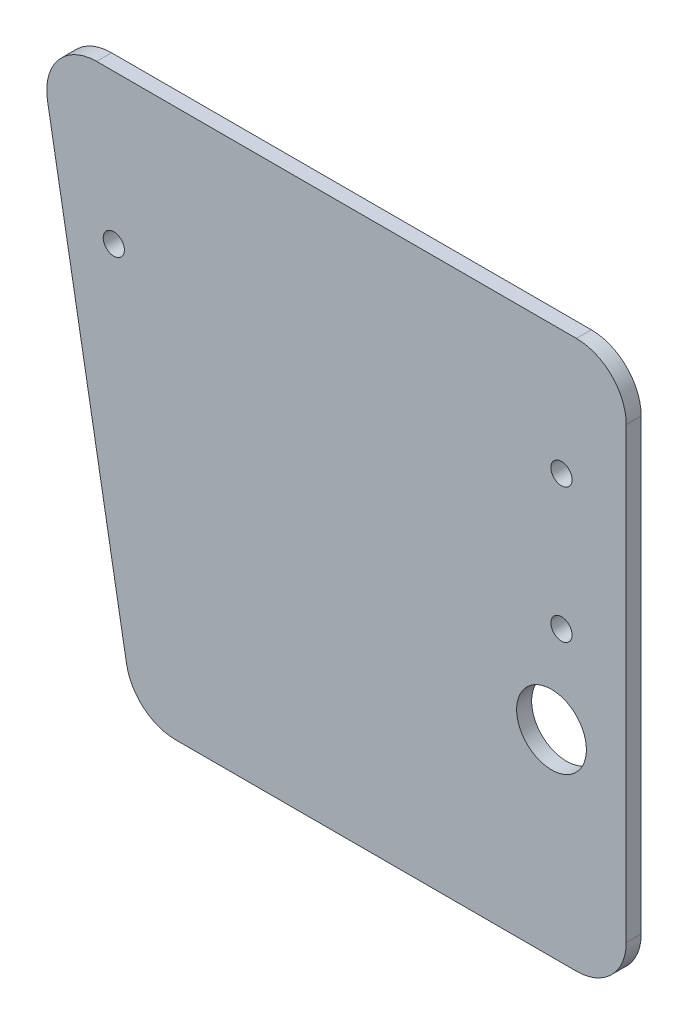
from build123d import *

# Parameters (mm, degrees)
BOSS_EXTRUDE3_DEPTH = 3
SKETCH5_R           = 2.125
SKETCH5_R_2         = 7
CUT_EXTRUDE1_DEPTH  = 10
FILLET1_R           = 10
SKETCH6_R           = 2.125
CUT_EXTRUDE2_DEPTH  = 3


with BuildPart() as part:
    # Sketch4 → Boss-Extrude3 (new body)
    with BuildSketch(Plane.XY):
        Polygon((0, 0), (118.235967878, 0), (118.235967878, -110), (19.395967878, -110), align=None)
    extrude(amount=BOSS_EXTRUDE3_DEPTH)

    # Sketch5 → Cut-Extrude1 (cut)
    with BuildSketch(Plane.XY.offset(3)):
        with Locations((105.235967878, -25)):
            Circle(SKETCH5_R)
        with Locations((15.3749641, -30)):
            Circle(SKETCH5_R)
        with Locations((103.235967878, -70.5)):
            Circle(SKETCH5_R_2)
    extrude(amount=-CUT_EXTRUDE1_DEPTH, mode=Mode.SUBTRACT)

    # Fillet1
    fillet1_edges = [part.edges().sort_by_distance(p)[0] for p in [
        (0, 0, 1.5),
        (118.235967878, 0, 1.5),
        (118.235967878, -110, 1.5),
        (19.395967878, -110, 1.5),
    ]]
    fillet(fillet1_edges, radius=FILLET1_R)

    # Sketch6 → Cut-Extrude2 (cut)
    with BuildSketch(Plane.XY.offset(3)):
        with Locations((105.235967878, -52)):
            Circle(SKETCH6_R)
    extrude(amount=-CUT_EXTRUDE2_DEPTH, mode=Mode.SUBTRACT)


solid = part.part
